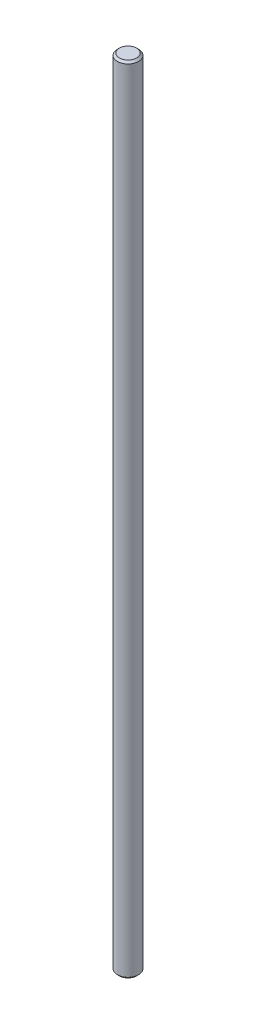
from build123d import *

# Parameters (mm, degrees)
SKETCH1_R           = 4
BOSS_EXTRUDE1_DEPTH = 300
CHAMFER1_SIZE       = 0.75


with BuildPart() as part:
    # Sketch1 → Boss-Extrude1 (new body)
    with BuildSketch(Plane(origin=(0, 0, 0), x_dir=(1, 0, 0), z_dir=(0, 1, 0))):
        with Locations(Location((0, 0, 0), (0, 0, 270))):
            Circle(SKETCH1_R)
    extrude(amount=BOSS_EXTRUDE1_DEPTH)

    # Chamfer1
    chamfer1_edges = [part.edges().sort_by_distance(p)[0] for p in [
        (0, 0, -4),
        (0, 300, -4),
    ]]
    chamfer(chamfer1_edges, length=CHAMFER1_SIZE)


solid = part.part
